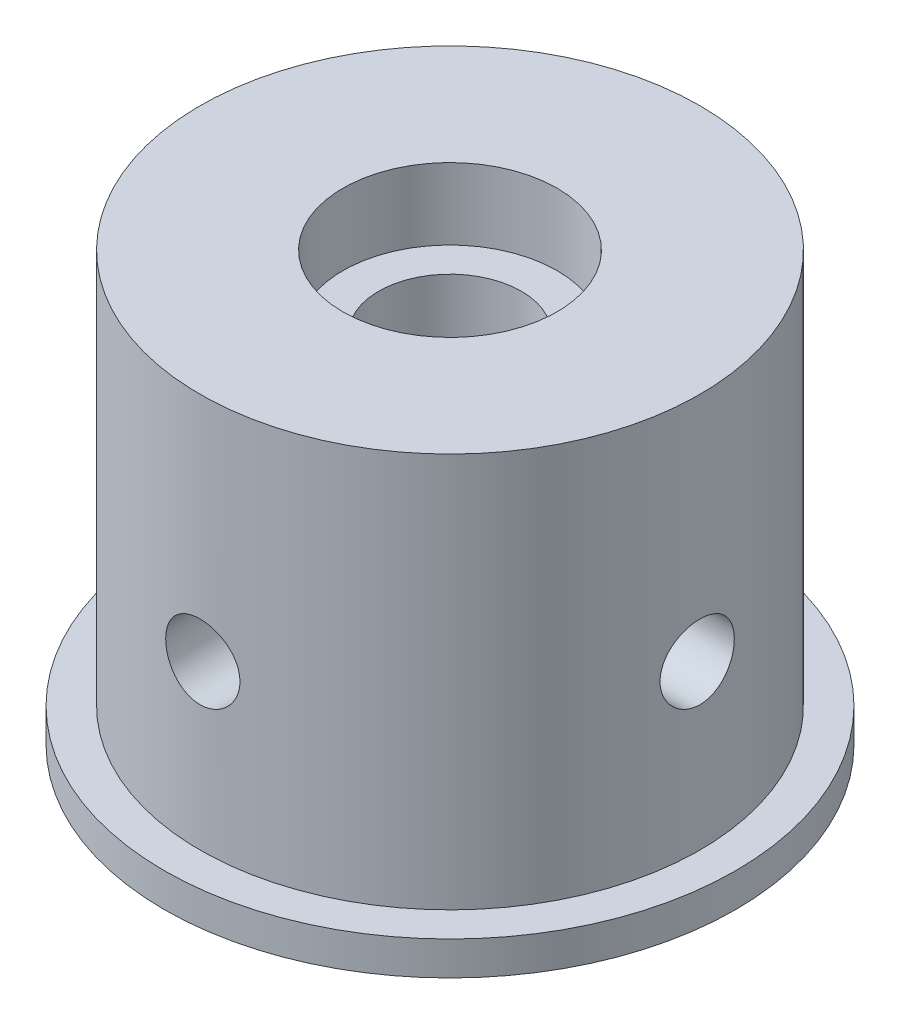
from build123d import *

# Parameters (mm, degrees)
CUT_EXTRUDE1_REACH      = 31.471
CUT_EXTRUDE1_END_RADIUS = 11.1125
CUT_EXTRUDE1_START      = -5.5
SKETCH2_R               = 1.65
CIRPATTERN1_COUNT       = 4


with BuildPart() as part:
    # Sketch1 → Revolve1 (revolve)
    with BuildSketch(Plane(origin=(0, 0, 0), x_dir=(0, 0, -1), z_dir=(1, 0, 0)), mode=Mode.PRIVATE) as revolve1_sk:
        Polygon((-3.175, 0), (-4.7625, 0), (-4.7625, -3.175), (-12.7, -3.175), (-12.7, -1.675), (-11.1125, -1.675), (-11.1125, 15.875), (-4.7625, 15.875), (-4.7625, 12.7), (-3.175, 12.7), align=None)
    revolve(revolve1_sk.sketch.rotate(Axis((0, -1000, 0), (0, 1, 0)), 180), axis=Axis((0, -1000, 0), (0, 1, 0)))

    # Cut-Extrude1: up to this cylinder (the profile starts inside it)
    cut_extrude1_end = Plane(origin=(0, 5.575, 0), z_dir=(0, -1, 0)) * Cylinder(CUT_EXTRUDE1_END_RADIUS, 86.167, mode=Mode.PRIVATE)
    # Sketch2 → Cut-Extrude1 (cut, up to the surface)
    with BuildSketch(Plane(origin=(0, 0, 0), x_dir=(0, 0, -1), z_dir=(1, 0, 0)).offset(CUT_EXTRUDE1_START), mode=Mode.PRIVATE) as cut_extrude1_sk1:
        with Locations((0, 5.575)):
            Circle(SKETCH2_R)
    cut_extrude1_tool1 = extrude(cut_extrude1_sk1.sketch, amount=-CUT_EXTRUDE1_REACH, mode=Mode.PRIVATE) & cut_extrude1_end
    cut_extrude1 = cut_extrude1_tool1.solids().sort_by_distance((-5.5, 5.575, 0))[0]
    add(cut_extrude1, mode=Mode.SUBTRACT)

    # CirPattern1: Cut-Extrude1 ×4 about axis
    cirpattern1_axis = Axis((0, 0, 0), (0, 1, 0))
    for i in range(1, CIRPATTERN1_COUNT):
        add(cut_extrude1.rotate(cirpattern1_axis, i * 360 / CIRPATTERN1_COUNT), mode=Mode.SUBTRACT)


solid = part.part
